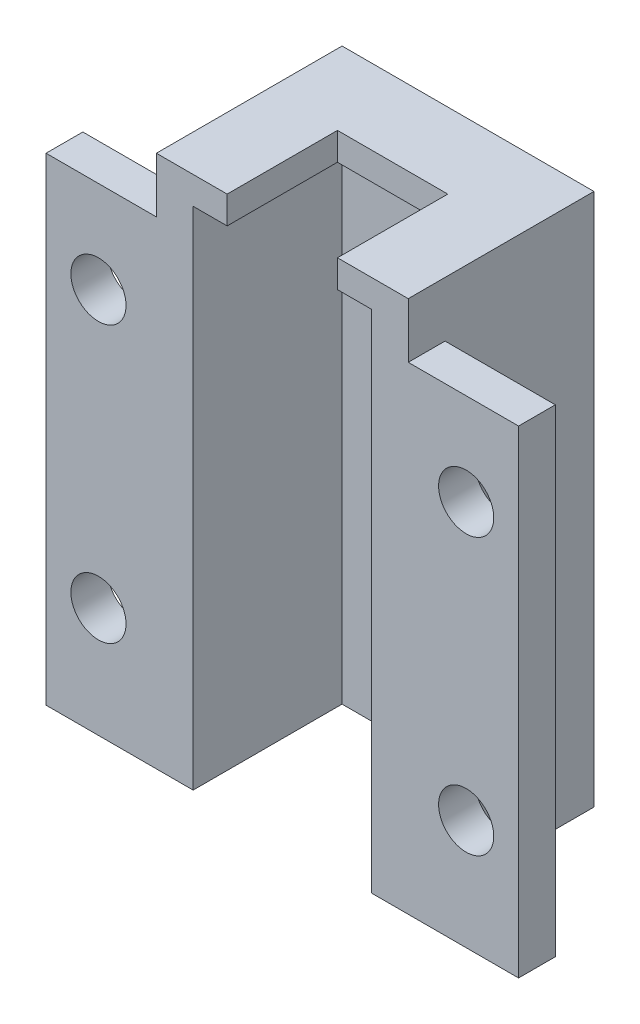
from build123d import *

# Parameters (mm, degrees)
BOSS_EXTRUDE1_DEPTH = 36.83
BOSS_EXTRUDE2_DEPTH = 1.905
SKETCH3_R           = 1.905
CUT_EXTRUDE1_DEPTH  = 2.54
SKETCH4_W           = 7.62
SKETCH4_H           = 3.81
CUT_EXTRUDE2_DEPTH  = 42.576403756


with BuildPart() as part:
    # Sketch1 → Boss-Extrude1 (new body)
    with BuildSketch(Plane(origin=(0, 0, 0), x_dir=(1, 0, 0), z_dir=(0, 1, 0))):
        Polygon((-16.3195, 0), (-6.1595, 0), (-6.1595, 10.287), (0, 10.287), (6.1595, 10.287), (6.1595, 0), (16.3195, 0), (16.3195, 2.54), (8.6995, 2.54), (8.6995, 12.827), (0, 12.827), (-8.6995, 12.827), (-8.6995, 2.54), (-16.3195, 2.54), align=None)
    extrude(amount=-BOSS_EXTRUDE1_DEPTH)

    # Sketch2 → Boss-Extrude2 (add)
    with BuildSketch(Plane(origin=(0, 0, 0), x_dir=(1, 0, 0), z_dir=(0, 1, 0))):
        Polygon((-8.6995, 12.827), (8.6995, 12.827), (8.6995, 0), (3.81, 0), (3.81, 7.62), (-3.81, 7.62), (-3.81, 0), (-8.6995, 0), align=None)
    extrude(amount=-BOSS_EXTRUDE2_DEPTH)

    # Sketch3 → Cut-Extrude1 (cut)
    with BuildSketch(Plane(origin=(0, 0, -2.54), x_dir=(-1, 0, 0), z_dir=(0, 0, -1))):
        with Locations((-12.7, -10.16)):
            Circle(SKETCH3_R)
        with Locations((-12.7, -29.21)):
            Circle(SKETCH3_R)
        with Locations(Location((12.7, -29.21, 0), (0, 0, 180))):
            Circle(SKETCH3_R)
        with Locations(Location((12.7, -10.16, 0), (0, 0, 180))):
            Circle(SKETCH3_R)
    extrude(amount=-CUT_EXTRUDE1_DEPTH, mode=Mode.SUBTRACT)

    # Sketch4 → Cut-Extrude2 (cut, through all)
    with BuildSketch(Plane(origin=(0, 0, -2.54), x_dir=(-1, 0, 0), z_dir=(0, 0, -1))):
        with Locations((-12.5095, -1.905)):
            Rectangle(SKETCH4_W, SKETCH4_H)
        with Locations((12.5095, -1.905)):
            Rectangle(SKETCH4_W, SKETCH4_H)
    extrude(amount=-CUT_EXTRUDE2_DEPTH, mode=Mode.SUBTRACT)


solid = part.part
